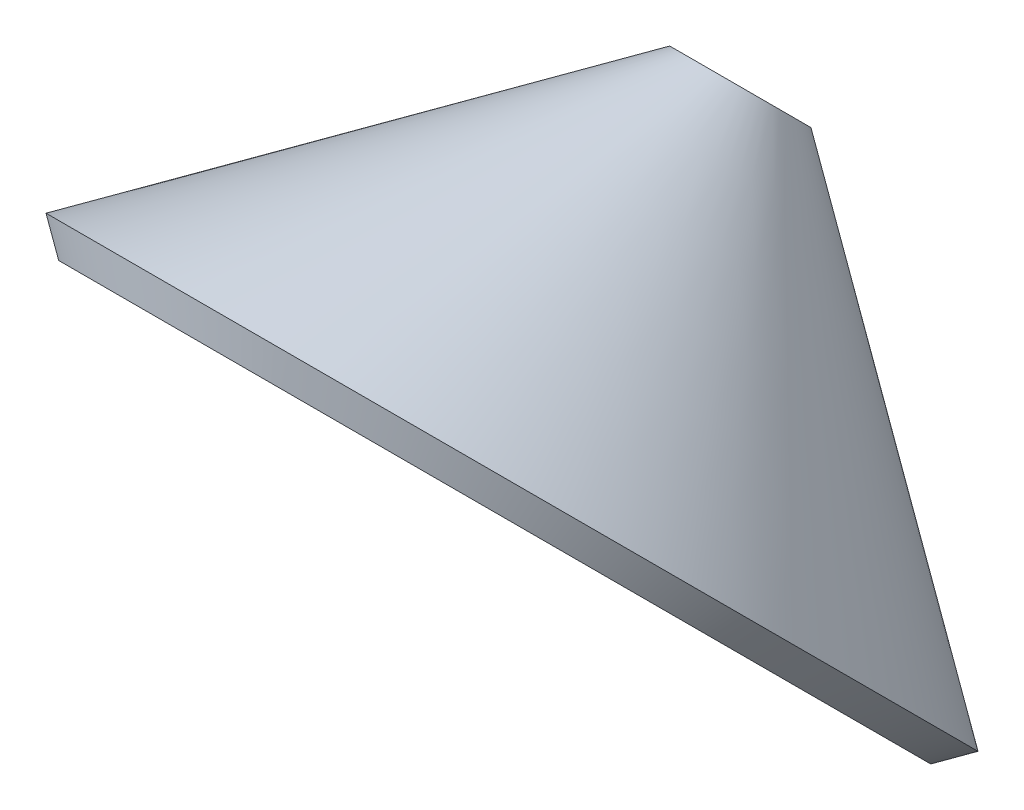
from build123d import *


with BuildPart() as part:
    # Esboço5 → Revolução1 (revolve)
    with BuildSketch(Plane(origin=(0, 0, 0), x_dir=(0, 0, -1), z_dir=(1, 0, 0))):
        with BuildLine():
            Line((-4, 28), (6, 28))
            Line((6, 28), (6, -28))
            Line((6, -28), (1.752133554, -28))
            Line((1.752133554, -28), (1.752133554, -4))
            Line((1.752133554, -4), (-2.370874425, -4))
            Line((-2.370874425, -4), (-2.370874425, 0))
            ThreePointArc((-2.370874425, 0), (0.180241373, 1.421453775), (0.313828383, 4.338794544))
            Line((0.313828383, 4.338794544), (-6, 17))
            Line((-6, 17), (-6, 26))
            Line((-6, 26), (-4, 28))
        make_face()
    revolve(axis=Axis((0, 28, 4), (0, -0.7071067811865436, 0.7071067811865516)))


solid = part.part
